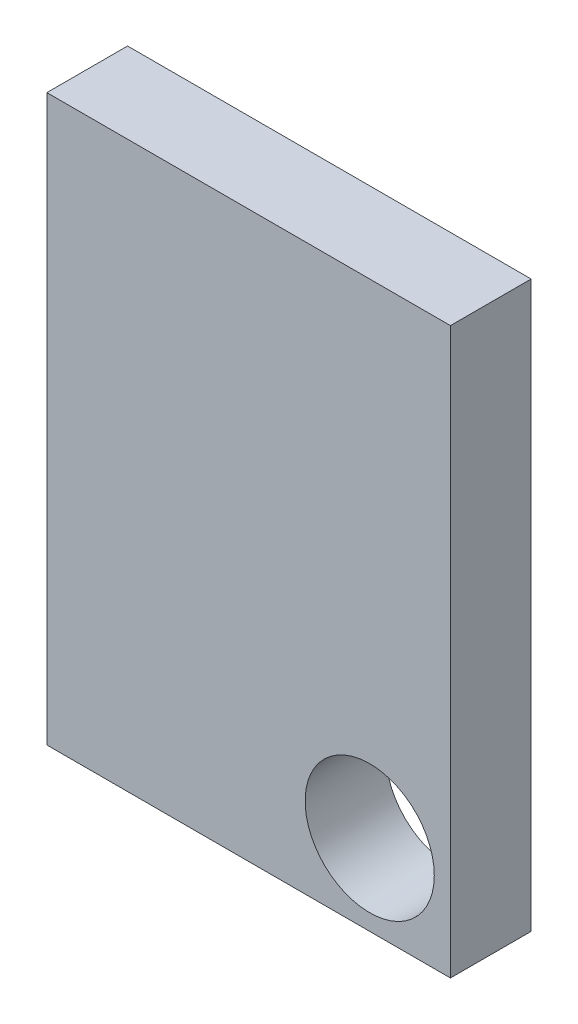
from build123d import *

# Parameters (mm, degrees)
SKETCH2_W           = 25
SKETCH2_H           = 35
BOSS_EXTRUDE1_DEPTH = 5
SKETCH6_R           = 4
CUT_EXTRUDE2_DEPTH  = 23.079402166


with BuildPart() as part:
    # Sketch2 → Boss-Extrude1 (new body)
    with BuildSketch(Plane.XY):
        Rectangle(SKETCH2_W, SKETCH2_H)
    extrude(amount=BOSS_EXTRUDE1_DEPTH)

    # Sketch6 → Cut-Extrude2 (cut, through all)
    with BuildSketch(Plane.XY.offset(5)):
        with Locations((7.5, -12.5)):
            Circle(SKETCH6_R)
    extrude(amount=-CUT_EXTRUDE2_DEPTH, mode=Mode.SUBTRACT)


solid = part.part
